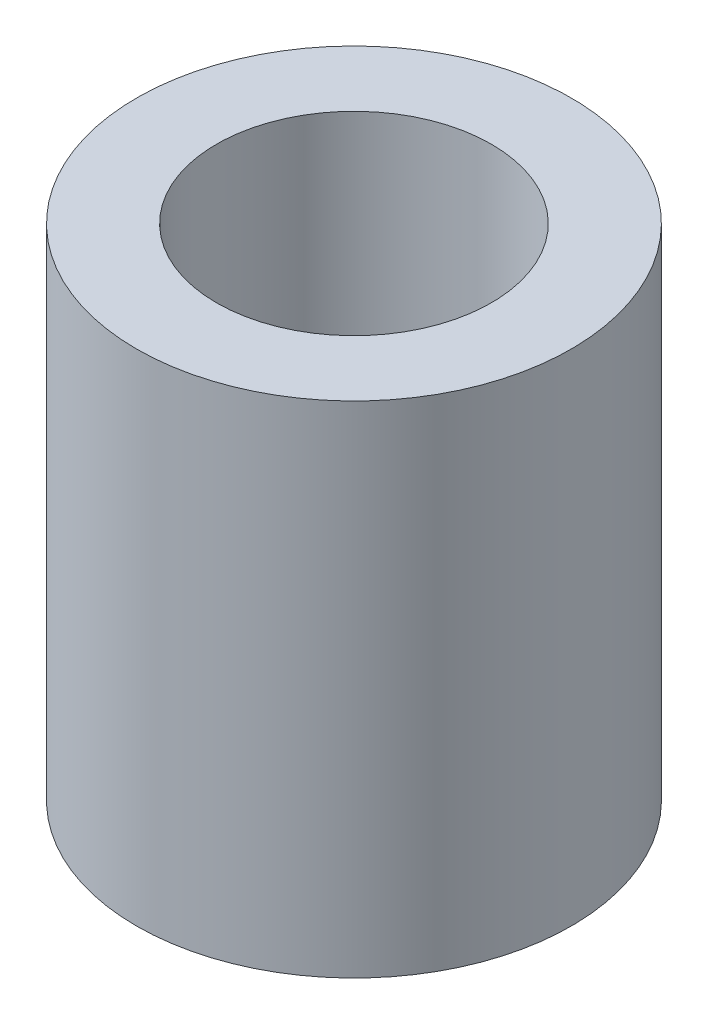
from build123d import *

# Parameters (mm, degrees)
SKETCH1_R           = 4.35
BOSS_EXTRUDE1_DEPTH = 10
SKETCH2_R           = 2.75
CUT_EXTRUDE1_DEPTH  = 9.4
SKETCH3_R           = 0.475
CUT_EXTRUDE2_DEPTH  = 12.234099875


with BuildPart() as part:
    # Sketch1 → Boss-Extrude1 (new body)
    with BuildSketch(Plane(origin=(0, 0, 0), x_dir=(1, 0, 0), z_dir=(0, 1, 0))):
        with Locations(Location((0, 0, 0), (0, 0, 270))):
            Circle(SKETCH1_R)
    extrude(amount=BOSS_EXTRUDE1_DEPTH)

    # Sketch2 → Cut-Extrude1 (cut)
    with BuildSketch(Plane(origin=(0, 10, 0), x_dir=(1, 0, 0), z_dir=(0, 1, 0))):
        with Locations(Location((0, 0, 0), (0, 0, 270))):
            Circle(SKETCH2_R)
    extrude(amount=-CUT_EXTRUDE1_DEPTH, mode=Mode.SUBTRACT)

    # Sketch3 → Cut-Extrude2 (cut, through all)
    with BuildSketch(Plane(origin=(0, 0.6, 0), x_dir=(1, 0, 0), z_dir=(0, 1, 0))):
        with Locations(Location((0, 0, 0), (0, 0, 270))):
            Circle(SKETCH3_R)
    extrude(amount=-CUT_EXTRUDE2_DEPTH, mode=Mode.SUBTRACT)


solid = part.part
